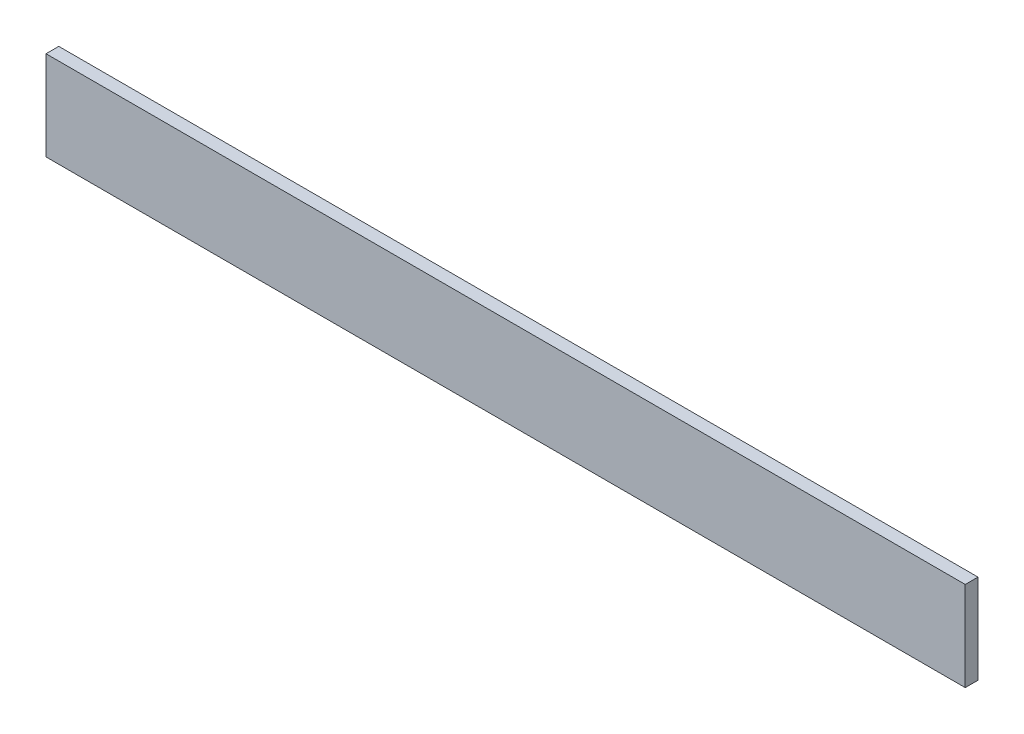
from build123d import *

# Parameters (mm, degrees)
SKETCH1_W           = 180
SKETCH1_H           = 17.5
BOSS_EXTRUDE1_DEPTH = 2.5


with BuildPart() as part:
    # Sketch1 → Boss-Extrude1 (new body)
    with BuildSketch(Plane.XY):
        with Locations((90, 8.75)):
            Rectangle(SKETCH1_W, SKETCH1_H)
    extrude(amount=BOSS_EXTRUDE1_DEPTH)


solid = part.part
